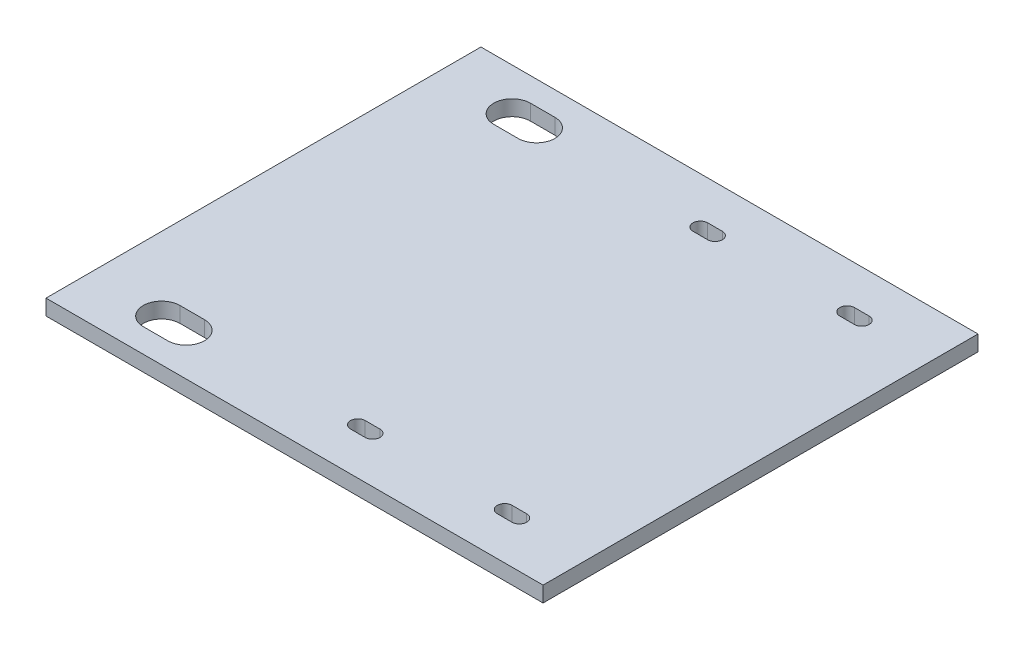
from build123d import *

# Parameters (mm, degrees)
SKETCH1_W           = 101.6
SKETCH1_H           = 88.9
BOSS_EXTRUDE1_DEPTH = 3.175
CUT_EXTRUDE1_DEPTH  = 68.576054376


with BuildPart() as part:
    # Sketch1 → Boss-Extrude1 (new body)
    with BuildSketch(Plane(origin=(0, 0, 0), x_dir=(1, 0, 0), z_dir=(0, 1, 0))):
        Rectangle(SKETCH1_W, SKETCH1_H)
    extrude(amount=BOSS_EXTRUDE1_DEPTH)

    # Sketch2 → Cut-Extrude1 (cut, through all)
    with BuildSketch(Plane(origin=(0, 3.175, 0), x_dir=(1, 0, 0), z_dir=(0, 1, 0))):
        with BuildLine():
            Line((-35.8, 39.564), (-30.8, 39.564))
            ThreePointArc((-30.8, 39.564), (-27.05, 35.814), (-30.8, 32.064))
            Line((-30.8, 32.064), (-35.8, 32.064))
            ThreePointArc((-35.8, 32.064), (-39.55, 35.814), (-35.8, 39.564))
        make_face()
        with BuildLine():
            Line((-35.8, -32.064), (-30.8, -32.064))
            ThreePointArc((-30.8, -32.064), (-27.05, -35.814), (-30.8, -39.564))
            Line((-30.8, -39.564), (-35.8, -39.564))
            ThreePointArc((-35.8, -39.564), (-39.55, -35.814), (-35.8, -32.064))
        make_face()
        with BuildLine():
            Line((3.5, 36.5), (6.5, 36.5))
            ThreePointArc((6.5, 36.5), (8, 35), (6.5, 33.5))
            Line((6.5, 33.5), (3.5, 33.5))
            ThreePointArc((3.5, 33.5), (2, 35), (3.5, 36.5))
        make_face()
        with BuildLine():
            Line((33.5, 36.5), (36.5, 36.5))
            ThreePointArc((36.5, 36.5), (38, 35), (36.5, 33.5))
            Line((36.5, 33.5), (33.5, 33.5))
            ThreePointArc((33.5, 33.5), (32, 35), (33.5, 36.5))
        make_face()
        with BuildLine():
            Line((3.5, -33.5), (6.5, -33.5))
            ThreePointArc((6.5, -33.5), (8, -35), (6.5, -36.5))
            Line((6.5, -36.5), (3.5, -36.5))
            ThreePointArc((3.5, -36.5), (2, -35), (3.5, -33.5))
        make_face()
        with BuildLine():
            Line((33.5, -33.5), (36.5, -33.5))
            ThreePointArc((36.5, -33.5), (38, -35), (36.5, -36.5))
            Line((36.5, -36.5), (33.5, -36.5))
            ThreePointArc((33.5, -36.5), (32, -35), (33.5, -33.5))
        make_face()
    extrude(amount=-CUT_EXTRUDE1_DEPTH, mode=Mode.SUBTRACT)


solid = part.part
